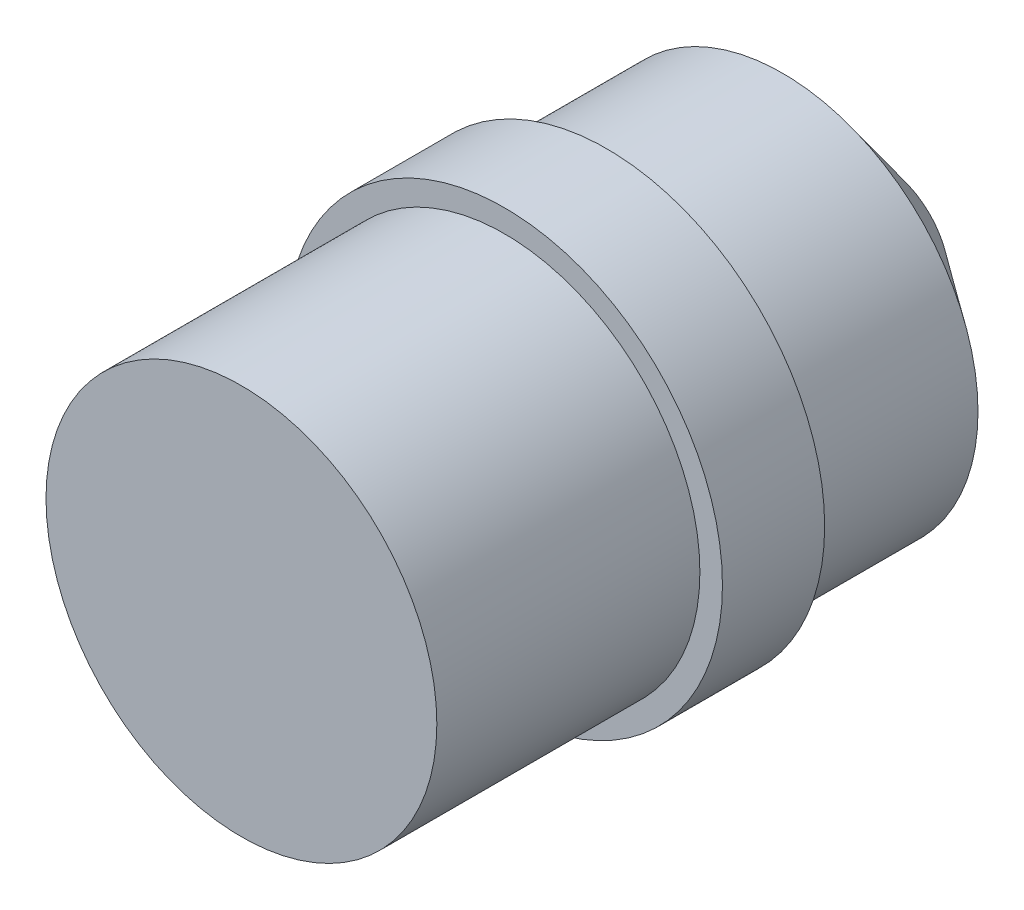
from build123d import *

# Parameters (mm, degrees)
SKETCH_1_R      = 14.5
EXTRUDE_1_DEPTH = 42.6
SKETCH_3_W      = 1.5
SKETCH_3_H      = 17.5


with BuildPart() as part:
    # 草圖1 → 填料-伸長1 (new body)
    with BuildSketch(Plane.XY):
        Circle(SKETCH_1_R)
    extrude(amount=EXTRUDE_1_DEPTH)

    # 草圖3 → 除料-旋轉1 (revolve, cut)
    with BuildSketch(Plane(origin=(0, 0, 0), x_dir=(1, 0, 0), z_dir=(0, 1, 0))):
        Polygon((-4.5, 0), (-13, -6.6), (-13, -18.3), (-14.5, -18.3), (-14.5, 0), align=None)
        with Locations((-13.75, -33.85)):
            Rectangle(SKETCH_3_W, SKETCH_3_H)
    revolve(axis=Axis((0, 0, 0), (0, 0, 1)), mode=Mode.SUBTRACT)


solid = part.part
